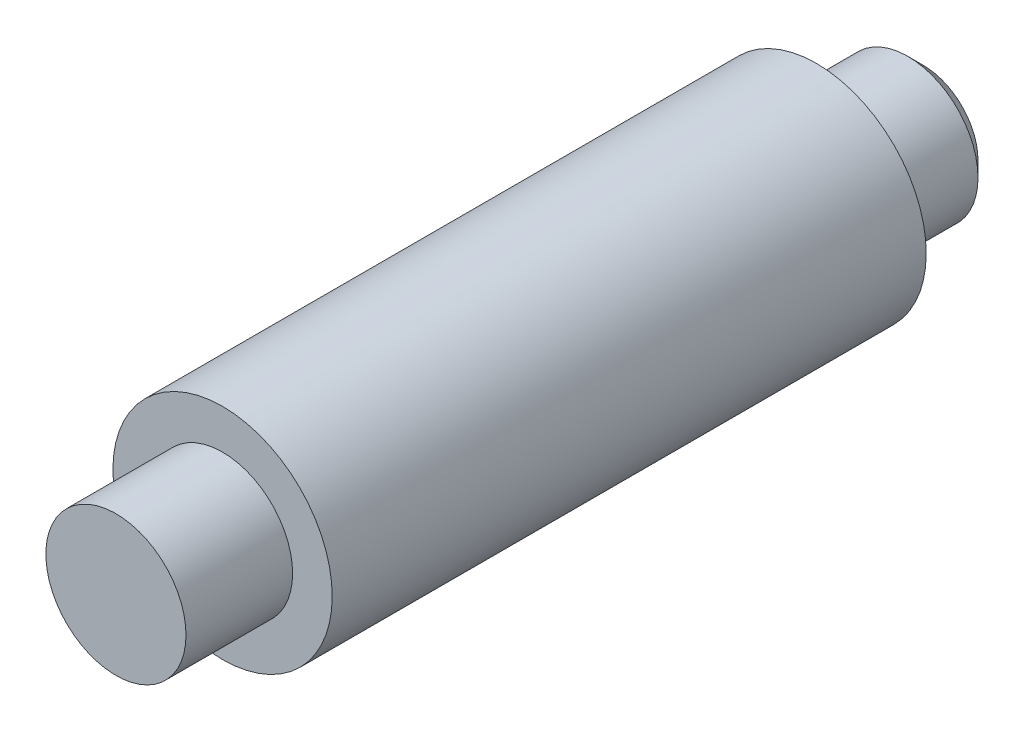
from build123d import *

# Parameters (mm, degrees)
SKETCH3_R           = 3.6
BOSS_EXTRUDE1_DEPTH = 19.5
SKETCH4_R           = 2.3
BOSS_EXTRUDE2_DEPTH = 3.5
BOSS_EXTRUDE3_START = 3.5
SKETCH5_R           = 2.3
BOSS_EXTRUDE3_DEPTH = 3.5
CHAMFER1_SIZE       = 0.5


with BuildPart() as part:
    # Sketch3 → Boss-Extrude1 (new body)
    with BuildSketch(Plane.XY):
        Circle(SKETCH3_R)
    extrude(amount=BOSS_EXTRUDE1_DEPTH)

    # Sketch4 → Boss-Extrude2 (add)
    with BuildSketch(Plane.XY):
        Circle(SKETCH4_R)
    extrude(amount=-BOSS_EXTRUDE2_DEPTH)

    # Sketch5 → Boss-Extrude3 (add)
    with BuildSketch(Plane.XY.offset(19.5).offset(BOSS_EXTRUDE3_START)):
        Circle(SKETCH5_R)
    extrude(amount=-BOSS_EXTRUDE3_DEPTH)

    # Chamfer1
    chamfer1_edges = [part.edges().sort_by_distance(p)[0] for p in [
        (-2.3, 0, -3.5),
    ]]
    chamfer(chamfer1_edges, length=CHAMFER1_SIZE)


solid = part.part
